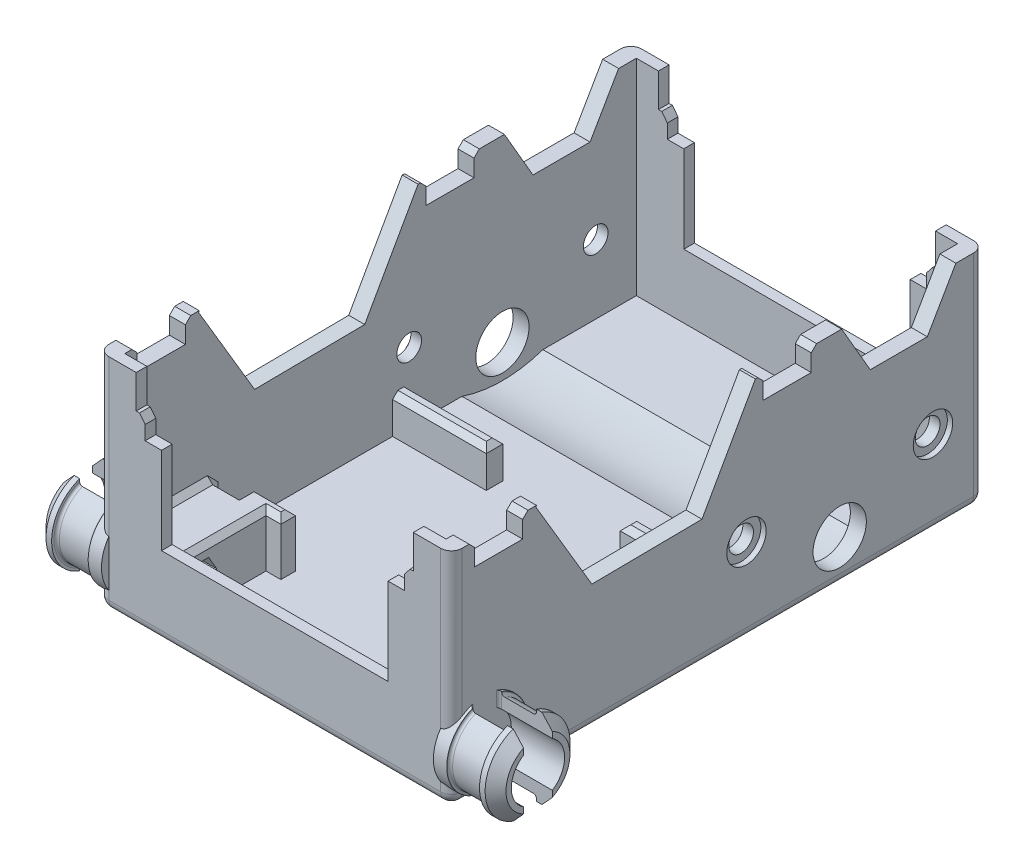
from build123d import *

# Parameters (mm, degrees)
SKETCH1_W                 = 66.29
SKETCH1_H                 = 100
BOSS_EXTRUDE1_DEPTH       = 41.59
SHELL2_T                  = -3
SHELL2_THICKNESS_2_FACE_W = 60.29
SHELL2_THICKNESS_2_FACE_H = 38.59
SHELL2_THICKNESS_2_DEPTH  = 1
SHELL2_THICKNESS_3_FACE_W = 60.29
SHELL2_THICKNESS_3_FACE_H = 38.59
SHELL2_THICKNESS_3_DEPTH  = 1
CUT_EXTRUDE1_DEPTH        = 125.59
FILLET1_R                 = 2
CUT_EXTRUDE2_REACH        = 128.981
SKETCH5_R                 = 5
SKETCH5_R_2               = 2.32
CUT_EXTRUDE3_START        = -3
SKETCH6_R                 = 23.5
CUT_EXTRUDE3_DEPTH        = 60.29
SKETCH7_R                 = 3.7
CUT_EXTRUDE4_DEPTH        = 1
BOSS_EXTRUDE2_DEPTH       = 10
SKETCH9_R                 = 1.5
CUT_EXTRUDE5_DEPTH        = 13
CUT_EXTRUDE6_START        = -6
SKETCH10_R                = 1.5
CUT_EXTRUDE6_DEPTH        = 6
CHAMFER1_SIZE             = 1
BOSS_EXTRUDE3_DEPTH       = 7
CHAMFER2_SIZE             = 1
SKETCH12_R                = 2.45
BOSS_EXTRUDE4_DEPTH       = 4
CHAMFER1_OF_MIRROR1_SIZE  = 1
CHAMFER2_OF_MIRROR1_SIZE  = 1
CUT_EXTRUDE7_REACH        = 130.572
SKETCH16_W                = 3
SKETCH16_H                = 0.2
CUT_EXTRUDE8_DEPTH        = 4.2
SKETCH17_W                = 9.044697424
SKETCH17_H                = 0.2
CUT_EXTRUDE9_DEPTH        = 66.29
CHAMFER3_SIZE             = 1
SKETCH20_W                = 10.005
SKETCH20_H                = 5.4
CUT_EXTRUDE11_DEPTH       = 16
FILLET2_R                 = 0.5
FILLET2_OF_MIRROR2_R      = 0.5


with BuildPart() as part:
    # Sketch1 → Boss-Extrude1 (new body)
    with BuildSketch(Plane(origin=(0, 0, 0), x_dir=(1, 0, 0), z_dir=(0, 1, 0))):
        with Locations((33.145, 50)):
            Rectangle(SKETCH1_W, SKETCH1_H)
    extrude(amount=BOSS_EXTRUDE1_DEPTH)

    # Shell2
    shell2_openings = [part.faces().sort_by_distance(p)[0] for p in [
        (33.145, 41.59, -50),
    ]]
    offset(amount=SHELL2_T, openings=shell2_openings, kind=Kind.INTERSECTION)

    # Shell2 thickness 2 face (on inner face of the shell) → Shell2 thickness 2 (cut)
    with BuildSketch(Plane(origin=(33.145, 22.295, -3), x_dir=(1, 0, 0), z_dir=(0, 0, 1))):
        Rectangle(SHELL2_THICKNESS_2_FACE_W, SHELL2_THICKNESS_2_FACE_H)
    extrude(amount=SHELL2_THICKNESS_2_DEPTH, mode=Mode.SUBTRACT)

    # Shell2 thickness 3 face (on inner face of the shell) → Shell2 thickness 3 (cut)
    with BuildSketch(Plane(origin=(33.145, 22.295, -97), x_dir=(-1, 0, 0), z_dir=(0, 0, -1))):
        Rectangle(SHELL2_THICKNESS_3_FACE_W, SHELL2_THICKNESS_3_FACE_H)
    extrude(amount=SHELL2_THICKNESS_3_DEPTH, mode=Mode.SUBTRACT)

    # Sketch3 → Cut-Extrude1 (cut)
    with BuildSketch(Plane.XY):
        Polygon((54.395, 15), (11.895, 15), (11.895, 31.32), (8.815, 31.32), (8.815, 33.97), (7.755, 35.32), (7.145, 35.32), (7.145, 41.59), (59.145, 41.59), (59.145, 35.32), (58.535, 35.32), (57.475, 33.97), (57.475, 31.32), (54.395, 31.32), align=None)
    extrude(amount=-CUT_EXTRUDE1_DEPTH, mode=Mode.SUBTRACT)

    # Fillet1
    fillet1_edges = [part.edges().sort_by_distance(p)[0] for p in [
        (33.145, 0, -100),
        (66.29, 0, -50),
        (33.145, 0, 0),
        (0, 0, -50),
        (0, 20.795, -100),
        (66.29, 20.795, -100),
        (66.29, 20.795, 0),
        (0, 20.795, 0),
    ]]
    fillet(fillet1_edges, radius=FILLET1_R)

    # Cut-Extrude2: up to this face of the body (flat: up to its plane)
    cut_extrude2_end = Plane(part.part.faces().sort_by_distance((66.29, 21.795, -50))[0])
    # Sketch5 → Cut-Extrude2 (cut, up to the picked face)
    with BuildSketch(Plane.ZY, mode=Mode.PRIVATE) as cut_extrude2_sk1:
        with Locations((-72.87, 8)):
            Circle(SKETCH5_R)
    cut_extrude2_tool1 = split(extrude(cut_extrude2_sk1.sketch, amount=-CUT_EXTRUDE2_REACH, mode=Mode.PRIVATE), bisect_by=cut_extrude2_end, keep=Keep.BOTH, mode=Mode.PRIVATE)
    # Sketch5 → Cut-Extrude2 (cut, up to the picked face)
    with BuildSketch(Plane.ZY, mode=Mode.PRIVATE) as cut_extrude2_sk2:
        with Locations((-90.37, 15.93)):
            Circle(SKETCH5_R_2)
    cut_extrude2_tool2 = split(extrude(cut_extrude2_sk2.sketch, amount=-CUT_EXTRUDE2_REACH, mode=Mode.PRIVATE), bisect_by=cut_extrude2_end, keep=Keep.BOTH, mode=Mode.PRIVATE)
    # Sketch5 → Cut-Extrude2 (cut, up to the picked face)
    with BuildSketch(Plane.ZY, mode=Mode.PRIVATE) as cut_extrude2_sk3:
        with Locations((-55.37, 15.93)):
            Circle(SKETCH5_R_2)
    cut_extrude2_tool3 = split(extrude(cut_extrude2_sk3.sketch, amount=-CUT_EXTRUDE2_REACH, mode=Mode.PRIVATE), bisect_by=cut_extrude2_end, keep=Keep.BOTH, mode=Mode.PRIVATE)
    add(cut_extrude2_tool1.solids().sort_by(Axis((0, 8, -72.87), (1, 0, 0)))[0], mode=Mode.SUBTRACT)
    add(cut_extrude2_tool2.solids().sort_by(Axis((0, 15.93, -90.37), (1, 0, 0)))[0], mode=Mode.SUBTRACT)
    add(cut_extrude2_tool3.solids().sort_by(Axis((0, 15.93, -55.37), (1, 0, 0)))[0], mode=Mode.SUBTRACT)

    # Sketch6 → Cut-Extrude3 (cut)
    with BuildSketch(Plane.ZY.offset(CUT_EXTRUDE3_START)):
        with Locations((-72.87, 25.24)):
            Circle(SKETCH6_R)
    extrude(amount=-CUT_EXTRUDE3_DEPTH, mode=Mode.SUBTRACT)

    # Sketch7 → Cut-Extrude4 (cut)
    with BuildSketch(Plane.ZY):
        with Locations((-55.37, 15.93)):
            Circle(SKETCH7_R)
        with Locations((-90.37, 15.93)):
            Circle(SKETCH7_R)
    cut_extrude4 = extrude(amount=-CUT_EXTRUDE4_DEPTH, mode=Mode.SUBTRACT)

    # Sketch8 → Boss-Extrude2 (add)
    with BuildSketch(Plane(origin=(0, 3, 0), x_dir=(1, 0, 0), z_dir=(0, 1, 0))):
        Polygon((3, 18.5), (3, 2), (13, 2), (13, 18.5), (15.79, 18.5), (15.79, 21.25), (8, 21.25), (8, 18.5), align=None)
    boss_extrude2 = extrude(amount=BOSS_EXTRUDE2_DEPTH)

    # Sketch9 → Cut-Extrude5 (cut)
    with BuildSketch(Plane.ZY):
        with Locations((-6.24, 8)):
            Circle(SKETCH9_R)
    cut_extrude5 = extrude(amount=-CUT_EXTRUDE5_DEPTH, mode=Mode.SUBTRACT)

    # Sketch10 → Cut-Extrude6 (cut)
    # profile 1 of 2: a face of its own
    with BuildSketch(Plane(origin=(13, 0, 0), x_dir=(0, 0, -1), z_dir=(1, 0, 0)).offset(CUT_EXTRUDE6_START)):
        Polygon((4.74, 5.401923789), (7.74, 5.401923789), (9.24, 8), (7.74, 10.598076211), (4.74, 10.598076211), (3.24, 8), align=None)
        with Locations(Location((6.24, 8, 0), (0, 0, 180))):
            Circle(SKETCH10_R, mode=Mode.SUBTRACT)
    # profile 2 of 2: a face of its own
    with BuildSketch(Plane(origin=(13, 0, 0), x_dir=(0, 0, -1), z_dir=(1, 0, 0)).offset(CUT_EXTRUDE6_START)):
        with Locations(Location((6.24, 8, 0), (0, 0, 180))):
            Circle(SKETCH10_R)
    cut_extrude6 = extrude(amount=CUT_EXTRUDE6_DEPTH, mode=Mode.SUBTRACT)

    # Chamfer1
    chamfer1_edges = [part.edges().sort_by_distance(p)[0] for p in [
        (3, 8, -18.5),
        (13, 13, -10.25),
        (13, 8, -2),
        (14.395, 13, -18.5),
        (15.79, 13, -19.875),
        (8, 13, -19.875),
        (5.5, 13, -18.5),
        (3, 13, -10.25),
        (8, 13, -2),
        (11.895, 13, -21.25),
    ]]
    chamfer(chamfer1_edges, length=CHAMFER1_SIZE)

    # Sketch11 → Boss-Extrude3 (add)
    with BuildSketch(Plane(origin=(0, 3, 0), x_dir=(1, 0, 0), z_dir=(0, 1, 0))):
        Polygon((8, 52.25), (20.582035751, 52.25), (20.582035751, 55.357324548), (3, 55.357324548), (3, 52.25), align=None)
    boss_extrude3 = extrude(amount=BOSS_EXTRUDE3_DEPTH)

    # Chamfer2
    chamfer2_edges = [part.edges().sort_by_distance(p)[0] for p in [
        (20.582035751, 10, -53.803662274),
        (11.791017876, 10, -55.357324548),
        (11.791017876, 10, -52.25),
    ]]
    chamfer(chamfer2_edges, length=CHAMFER2_SIZE)

    # Sketch12 → Boss-Extrude4 (add)
    # profile 1 of 2: a face of its own
    with BuildSketch(Plane(origin=(0, 41.59, 0), x_dir=(1, 0, 0), z_dir=(0, 1, 0))):
        Polygon((8.145, 13.174697424), (33.145, 13.174697424), (33.145, 4.53), (8.145, 4.53), (-3, 4.53), (-3, 13.174697424), align=None)
        with Locations(Location((8.145, 8.43, 0), (0, 0, 270))):
            Circle(SKETCH12_R, mode=Mode.SUBTRACT)
    # profile 2 of 2: a face of its own
    with BuildSketch(Plane(origin=(0, 41.59, 0), x_dir=(1, 0, 0), z_dir=(0, 1, 0))):
        Polygon((8.145, 58.685302576), (-3, 58.685302576), (-3, 67.33), (8.145, 67.33), (33.145, 67.33), (33.145, 58.685302576), align=None)
        with Locations(Location((8.145, 63.43, 0), (0, 0, 270))):
            Circle(SKETCH12_R, mode=Mode.SUBTRACT)
    boss_extrude4 = extrude(amount=-BOSS_EXTRUDE4_DEPTH)

    # Mirror1: Cut-Extrude4, Boss-Extrude2, Cut-Extrude5, Cut-Extrude6, Boss-Extrude3, Boss-Extrude4 across plane
    add(cut_extrude4.mirror(Plane.ZY.offset(-33.145)), mode=Mode.SUBTRACT)
    add(boss_extrude2.mirror(Plane.ZY.offset(-33.145)))
    add(cut_extrude5.mirror(Plane.ZY.offset(-33.145)), mode=Mode.SUBTRACT)
    add(cut_extrude6.mirror(Plane.ZY.offset(-33.145)), mode=Mode.SUBTRACT)
    add(boss_extrude3.mirror(Plane.ZY.offset(-33.145)))
    add(boss_extrude4.mirror(Plane.ZY.offset(-33.145)))

    # Chamfer1 of Mirror1
    chamfer1_of_mirror1_edges = [part.edges().sort_by_distance(p)[0] for p in [
        (63.29, 8, -18.5),
        (53.29, 13, -10.25),
        (53.29, 8, -2),
        (51.895, 13, -18.5),
        (50.5, 13, -19.875),
        (58.29, 13, -19.875),
        (60.79, 13, -18.5),
        (63.29, 13, -10.25),
        (58.29, 13, -2),
        (54.395, 13, -21.25),
    ]]
    chamfer(chamfer1_of_mirror1_edges, length=CHAMFER1_OF_MIRROR1_SIZE)

    # Chamfer2 of Mirror1
    chamfer2_of_mirror1_edges = [part.edges().sort_by_distance(p)[0] for p in [
        (45.707964249, 10, -53.803662274),
        (54.498982124, 10, -55.357324548),
        (54.498982124, 10, -52.25),
    ]]
    chamfer(chamfer2_of_mirror1_edges, length=CHAMFER2_OF_MIRROR1_SIZE)

    # Cut-Extrude7: up to this face of the body (flat: up to its plane)
    cut_extrude7_end = Plane(part.part.faces().sort_by_distance((0, 21.922757181, -49.303050244))[0])
    # Sketch13 → Cut-Extrude7 (cut, up to the picked face)
    with BuildSketch(Plane(origin=(66.29, 0, 0), x_dir=(0, 0, -1), z_dir=(1, 0, 0)), mode=Mode.PRIVATE) as cut_extrude7_sk1:
        Polygon((15.839041752, 41.371414907), (26.360630861, 23.584658178), (47.025208595, 23.803243271), (57.168197218, 41.808585093), (46.646608109, 59.595341822), (25.982030375, 59.376756729), align=None)
    cut_extrude7_tool1 = split(extrude(cut_extrude7_sk1.sketch, amount=-CUT_EXTRUDE7_REACH, mode=Mode.PRIVATE), bisect_by=cut_extrude7_end, keep=Keep.BOTH, mode=Mode.PRIVATE)
    # Sketch13 → Cut-Extrude7 (cut, up to the picked face)
    with BuildSketch(Plane(origin=(66.29, 0, 0), x_dir=(0, 0, -1), z_dir=(1, 0, 0)), mode=Mode.PRIVATE) as cut_extrude7_sk2:
        Polygon((73.241690704, 41.59), (78.598611092, 32.311541717), (89.312451867, 32.311541717), (94.669372255, 41.59), (89.312451867, 50.868458283), (78.598611092, 50.868458283), align=None)
    cut_extrude7_tool2 = split(extrude(cut_extrude7_sk2.sketch, amount=-CUT_EXTRUDE7_REACH, mode=Mode.PRIVATE), bisect_by=cut_extrude7_end, keep=Keep.BOTH, mode=Mode.PRIVATE)
    add(cut_extrude7_tool1.solids().sort_by(Axis((66.29, 41.59, -36.503619), (-1, 0, 0)))[0], mode=Mode.SUBTRACT)
    add(cut_extrude7_tool2.solids().sort_by(Axis((66.29, 41.59, -83.955531), (-1, 0, 0)))[0], mode=Mode.SUBTRACT)

    # Sketch16 → Cut-Extrude8 (cut)
    with BuildSketch(Plane(origin=(0, 41.59, 0), x_dir=(1, 0, 0), z_dir=(0, 1, 0))):
        with Locations((1.5, 67.43)):
            Rectangle(SKETCH16_W, SKETCH16_H)
        with Locations((1.5, 58.585302576)):
            Rectangle(SKETCH16_W, SKETCH16_H)
        with Locations((1.5, 4.43)):
            Rectangle(SKETCH16_W, SKETCH16_H)
        with Locations((1.5, 13.274697424)):
            Rectangle(SKETCH16_W, SKETCH16_H)
        with Locations((64.79, 13.274697424)):
            Rectangle(SKETCH16_W, SKETCH16_H)
        with Locations((64.79, 4.43)):
            Rectangle(SKETCH16_W, SKETCH16_H)
        with Locations((64.79, 58.585302576)):
            Rectangle(SKETCH16_W, SKETCH16_H)
        with Locations((64.79, 67.43)):
            Rectangle(SKETCH16_W, SKETCH16_H)
    extrude(amount=-CUT_EXTRUDE8_DEPTH, mode=Mode.SUBTRACT)

    # Sketch17 → Cut-Extrude9 (cut)
    with BuildSketch(Plane.ZY):
        with Locations((-63.007651288, 37.49)):
            Rectangle(SKETCH17_W, SKETCH17_H)
        with Locations((-8.852348712, 37.49)):
            Rectangle(SKETCH17_W, SKETCH17_H)
    extrude(amount=-CUT_EXTRUDE9_DEPTH, mode=Mode.SUBTRACT)


with BuildPart() as cut_extrude9_piece_1:
    # of the separate pieces the step leaves, piece 1, a body of its own (cut_extrude9_pieces)
    add(part.part.solids().sort_by_distance((63.29, 9, -52.25))[0])

    # Chamfer3
    chamfer3_edges = [cut_extrude9_piece_1.edges().sort_by_distance(p)[0] for p in [
        (64.79, 41.59, -13.374697424),
        (64.79, 41.59, -4.33),
        (64.79, 41.59, -58.485302576),
        (64.79, 41.59, -67.53),
        (1.5, 41.59, -13.374697424),
        (1.5, 41.59, -4.33),
        (1.5, 41.59, -67.53),
        (1.5, 41.59, -58.485302576),
    ]]
    chamfer(chamfer3_edges, length=CHAMFER3_SIZE)

    # Sketch18 → Revolve1 (revolve)
    with BuildSketch(Plane(origin=(0, 0, -6.24), x_dir=(-1, 0, 0), z_dir=(0, 0, -1)), mode=Mode.PRIVATE) as revolve1_sk:
        Polygon((0, 15.614789875), (0.505, 15.614789875), (0.505, 15.012), (7.005, 15.012), (7.005, 15.971), (8.055, 15.971), (10.005, 14), (10.005, 13), (0, 13), (-2, 13), (-2, 15.614789875), align=None)
    revolve1 = revolve(revolve1_sk.sketch.rotate(Axis((-0.505, 8, -6.24), (-1, 0, 0)), 90), axis=Axis((-0.505, 8, -6.24), (-1, 0, 0)))

    # Sketch20 → Cut-Extrude11 (cut)
    with BuildSketch(Plane(origin=(0, 0, 0), x_dir=(1, 0, 0), z_dir=(0, 1, 0))):
        with Locations((-5.0025, 6.24)):
            Rectangle(SKETCH20_W, SKETCH20_H)
    cut_extrude11 = extrude(amount=CUT_EXTRUDE11_DEPTH, mode=Mode.SUBTRACT)

    # Fillet2
    fillet2_edges = [cut_extrude9_piece_1.edges().sort_by_distance(p)[0] for p in [
        (-7.005, 8, 0.772),
        (-7.005, 8, -13.252),
        (-0.505, 8, 0.772),
        (-0.505, 8, -13.252),
        (0, 2.335815519, -3.54),
        (0, 13.664184481, -3.54),
        (0, 2.335815519, -8.94),
        (0, 13.664184481, -8.94),
    ]]
    fillet(fillet2_edges, radius=FILLET2_R)

    # Mirror2: Revolve1, Cut-Extrude11 across plane
    add(revolve1.mirror(Plane.ZY.offset(-33.145)))
    add(cut_extrude11.mirror(Plane.ZY.offset(-33.145)), mode=Mode.SUBTRACT)

    # Fillet2 of Mirror2
    fillet2_of_mirror2_edges = [cut_extrude9_piece_1.edges().sort_by_distance(p)[0] for p in [
        (73.295, 8, 0.772),
        (73.295, 8, -13.252),
        (66.795, 8, 0.772),
        (66.795, 8, -13.252),
        (66.29, 2.335815519, -3.54),
        (66.29, 13.664184481, -3.54),
        (66.29, 2.335815519, -8.94),
        (66.29, 13.664184481, -8.94),
    ]]
    fillet(fillet2_of_mirror2_edges, radius=FILLET2_OF_MIRROR2_R)


with BuildPart() as cut_extrude9_piece_2:
    # of the separate pieces the step leaves, piece 2, a body of its own (cut_extrude9_pieces)
    add(part.part.solids().sort_by_distance((69.29, 37.59, -58.685302576))[0])


with BuildPart() as cut_extrude9_piece_3:
    # of the separate pieces the step leaves, piece 3, a body of its own (cut_extrude9_pieces)
    add(part.part.solids().sort_by_distance((69.29, 37.59, -4.53))[0])


solid = cut_extrude9_piece_1.part
